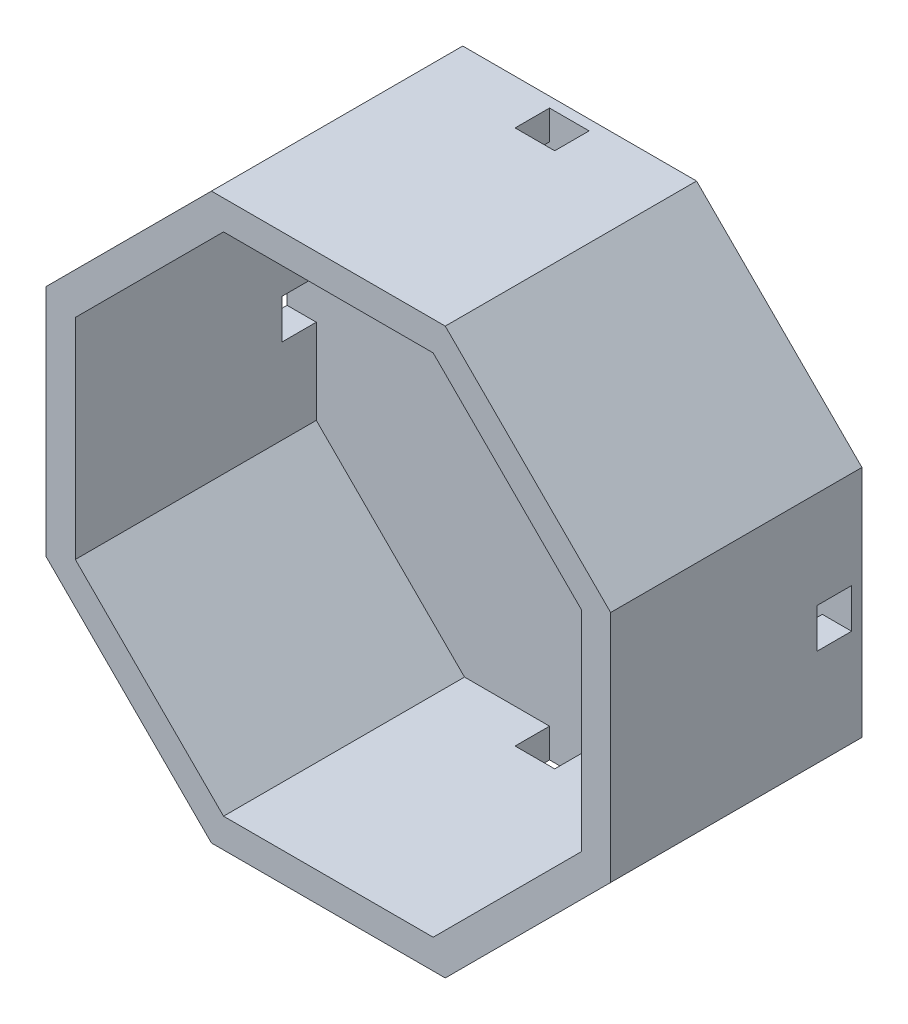
from build123d import *

# Parameters (mm, degrees)
BOSS_EXTRUDE1_DEPTH   = 3
BOSS_EXTRUDE2_DEPTH   = 70
CUT_EXTRUDE1_DEPTH    = 170
SKETCH4_W             = 11.5
SKETCH4_H             = 10
CUT_EXTRUDE2_DEPTH    = 170
BODY_MOVE_COPY2_ANGLE = 90


with BuildPart() as part:
    # Sketch1 → Boss-Extrude1 (new body)
    with BuildSketch(Plane(origin=(0, 0, 0), x_dir=(1, 0, 0), z_dir=(0, 1, 0))):
        Polygon((0, -82), (0, 0), (-82, 0), (-82, -33.965), (-33.964997557, -82), align=None)
        Polygon((82, 0), (0, 0), (0, -82), (33.965002443, -82), (82, -33.965), align=None)
        Polygon((-82, 0), (0, 0), (82, 0), (82, 33.965), (33.965002443, 82), (-33.964997557, 82), (-82, 33.965), align=None)
    extrude(amount=BOSS_EXTRUDE1_DEPTH)

    # Sketch2 → Boss-Extrude2 (add)
    with BuildSketch(Plane(origin=(0, 3, 0), x_dir=(1, 0, 0), z_dir=(0, 1, 0))):
        Polygon((33.965002443, -82), (82, -33.965), (82, 33.965), (33.965002443, 82), (-33.964997557, 82), (-82, 33.965), (-82, -33.965), (-33.964997557, -82), align=None)
        Polygon((-30.44418472, 73.5), (30.44418472, 73.5), (73.5, 30.44418472), (73.5, -30.44418472), (30.44418472, -73.5), (-30.44418472, -73.5), (-73.5, -30.44418472), (-73.5, 30.44418472), align=None, mode=Mode.SUBTRACT)
    extrude(amount=BOSS_EXTRUDE2_DEPTH)

    # Sketch3 → Cut-Extrude1 (cut)
    with BuildSketch(Plane(origin=(82, 0, 0), x_dir=(0, 0, -1), z_dir=(1, 0, 0))):
        Polygon((-5.75, 13), (-5.75, 3), (0, 3), (5.75, 3), (5.75, 13), align=None)
    extrude(amount=-CUT_EXTRUDE1_DEPTH, mode=Mode.SUBTRACT)

    # Sketch4 → Cut-Extrude2 (cut)
    with BuildSketch(Plane(origin=(0, 0, -82), x_dir=(-1, 0, 0), z_dir=(0, 0, -1))):
        with Locations((0, 8)):
            Rectangle(SKETCH4_W, SKETCH4_H)
    extrude(amount=-CUT_EXTRUDE2_DEPTH, mode=Mode.SUBTRACT)


with BuildPart() as part_1:
    # Body-Move/Copy2: moved
    add(part.part.rotate(Axis((0, 36.5, 0), (1, 0, 0)), BODY_MOVE_COPY2_ANGLE))


solid = part_1.part
